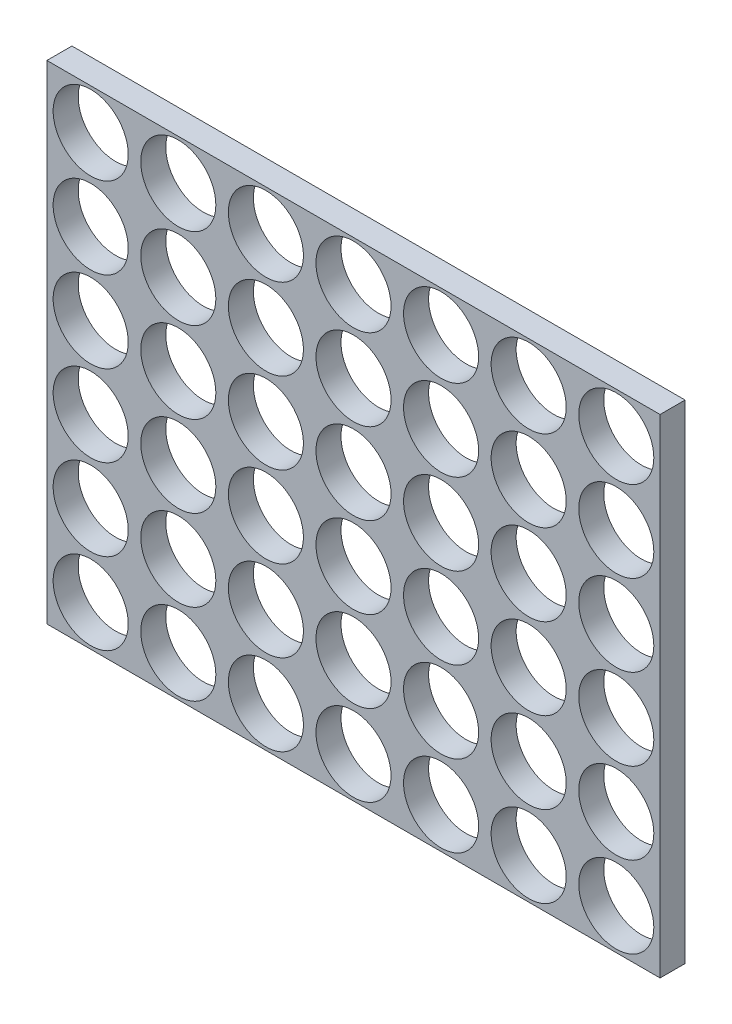
from build123d import *

# Parameters (mm, degrees)
SKETCH1_W           = 245
SKETCH1_H           = 195
SKETCH1_R           = 15
BOSS_EXTRUDE1_DEPTH = 10


with BuildPart() as part:
    # Sketch1 → Boss-Extrude1 (new body)
    with BuildSketch(Plane.XY):
        Rectangle(SKETCH1_W, SKETCH1_H)
        with Locations((-105, 81.25)):
            Circle(SKETCH1_R, mode=Mode.SUBTRACT)
        with Locations((-70, 81.25)):
            Circle(SKETCH1_R, mode=Mode.SUBTRACT)
        with Locations((-35, 81.25)):
            Circle(SKETCH1_R, mode=Mode.SUBTRACT)
        with Locations((0, 81.25)):
            Circle(SKETCH1_R, mode=Mode.SUBTRACT)
        with Locations((35, 81.25)):
            Circle(SKETCH1_R, mode=Mode.SUBTRACT)
        with Locations((70, 81.25)):
            Circle(SKETCH1_R, mode=Mode.SUBTRACT)
        with Locations((105, 81.25)):
            Circle(SKETCH1_R, mode=Mode.SUBTRACT)
        with Locations((-70, 48.75)):
            Circle(SKETCH1_R, mode=Mode.SUBTRACT)
        with Locations((-35, 48.75)):
            Circle(SKETCH1_R, mode=Mode.SUBTRACT)
        with Locations((0, 48.75)):
            Circle(SKETCH1_R, mode=Mode.SUBTRACT)
        with Locations((35, 48.75)):
            Circle(SKETCH1_R, mode=Mode.SUBTRACT)
        with Locations((70, 48.75)):
            Circle(SKETCH1_R, mode=Mode.SUBTRACT)
        with Locations((105, 48.75)):
            Circle(SKETCH1_R, mode=Mode.SUBTRACT)
        with Locations((-70, 16.25)):
            Circle(SKETCH1_R, mode=Mode.SUBTRACT)
        with Locations((-35, 16.25)):
            Circle(SKETCH1_R, mode=Mode.SUBTRACT)
        with Locations((0, 16.25)):
            Circle(SKETCH1_R, mode=Mode.SUBTRACT)
        with Locations((35, 16.25)):
            Circle(SKETCH1_R, mode=Mode.SUBTRACT)
        with Locations((70, 16.25)):
            Circle(SKETCH1_R, mode=Mode.SUBTRACT)
        with Locations((105, 16.25)):
            Circle(SKETCH1_R, mode=Mode.SUBTRACT)
        with Locations((-70, -16.25)):
            Circle(SKETCH1_R, mode=Mode.SUBTRACT)
        with Locations((-35, -16.25)):
            Circle(SKETCH1_R, mode=Mode.SUBTRACT)
        with Locations((0, -16.25)):
            Circle(SKETCH1_R, mode=Mode.SUBTRACT)
        with Locations((35, -16.25)):
            Circle(SKETCH1_R, mode=Mode.SUBTRACT)
        with Locations((70, -16.25)):
            Circle(SKETCH1_R, mode=Mode.SUBTRACT)
        with Locations((105, -16.25)):
            Circle(SKETCH1_R, mode=Mode.SUBTRACT)
        with Locations((-70, -48.75)):
            Circle(SKETCH1_R, mode=Mode.SUBTRACT)
        with Locations((-35, -48.75)):
            Circle(SKETCH1_R, mode=Mode.SUBTRACT)
        with Locations((0, -48.75)):
            Circle(SKETCH1_R, mode=Mode.SUBTRACT)
        with Locations((35, -48.75)):
            Circle(SKETCH1_R, mode=Mode.SUBTRACT)
        with Locations((70, -48.75)):
            Circle(SKETCH1_R, mode=Mode.SUBTRACT)
        with Locations((105, -48.75)):
            Circle(SKETCH1_R, mode=Mode.SUBTRACT)
        with Locations((-70, -81.25)):
            Circle(SKETCH1_R, mode=Mode.SUBTRACT)
        with Locations((-35, -81.25)):
            Circle(SKETCH1_R, mode=Mode.SUBTRACT)
        with Locations((0, -81.25)):
            Circle(SKETCH1_R, mode=Mode.SUBTRACT)
        with Locations((35, -81.25)):
            Circle(SKETCH1_R, mode=Mode.SUBTRACT)
        with Locations((70, -81.25)):
            Circle(SKETCH1_R, mode=Mode.SUBTRACT)
        with Locations((105, -81.25)):
            Circle(SKETCH1_R, mode=Mode.SUBTRACT)
        with Locations((-105, 48.75)):
            Circle(SKETCH1_R, mode=Mode.SUBTRACT)
        with Locations((-105, 16.25)):
            Circle(SKETCH1_R, mode=Mode.SUBTRACT)
        with Locations((-105, -16.25)):
            Circle(SKETCH1_R, mode=Mode.SUBTRACT)
        with Locations((-105, -48.75)):
            Circle(SKETCH1_R, mode=Mode.SUBTRACT)
        with Locations((-105, -81.25)):
            Circle(SKETCH1_R, mode=Mode.SUBTRACT)
    extrude(amount=BOSS_EXTRUDE1_DEPTH)


solid = part.part
